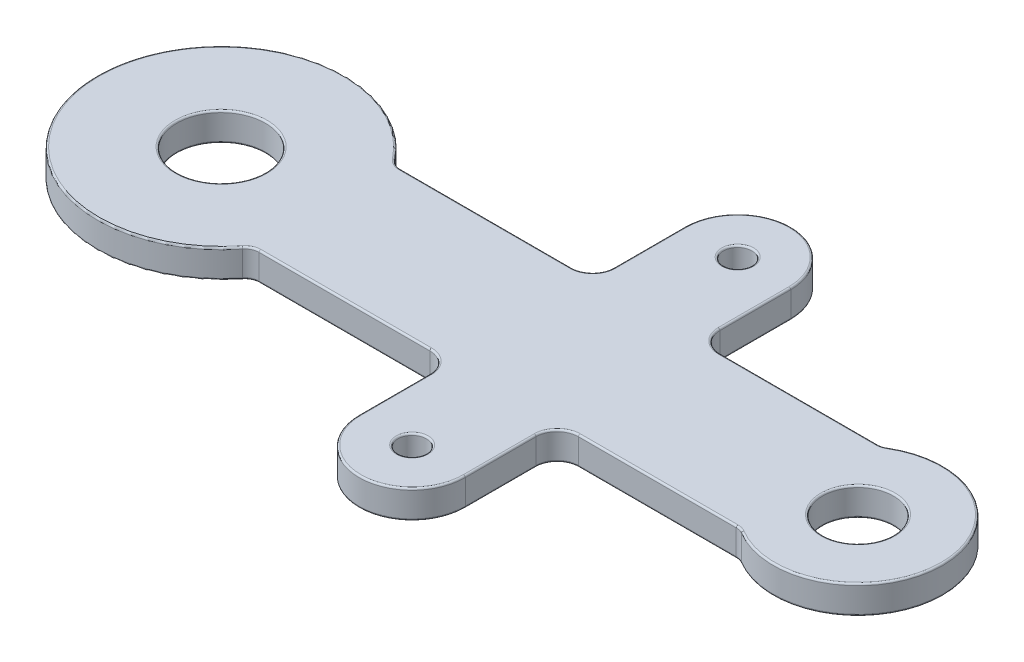
from build123d import *

# Parameters (mm, degrees)
SKETCH_1_R      = 12.5
SKETCH_1_R_2    = 4
SKETCH_1_R_3    = 10
EXTRUDE_1_DEPTH = 8
FILLET_1_R      = 6
FILLET_2_R      = 6
FILLET_3_R      = 6
FILLET_4_R      = 6
FILLET_5_R      = 4
FILLET_6_R      = 4
FILLET_7_R      = 4
FILLET_8_R      = 4
FILLET_9_R      = 0.5


with BuildPart() as part:
    # 草图1 → 凸台-拉伸1 (new body)
    with BuildSketch(Plane(origin=(0, 0, 0), x_dir=(1, 0, 0), z_dir=(0, 1, 0))):
        with BuildLine():
            Line((28.719409623, 20.004887175), (85, 20.004887175))
            Line((85, 20.004887175), (85, 46))
            ThreePointArc((85, 46), (100, 61), (115, 46))
            Line((115, 46), (115, 20.004887175))
            Line((115, 20.004887175), (166.74087148, 20.004887175))
            ThreePointArc((166.74087148, 20.004887175), (204, 0), (166.74087148, -20.004887175))
            Line((166.74087148, -20.004887175), (115, -20.004887175))
            Line((115, -20.004887175), (115, -46))
            ThreePointArc((115, -46), (100, -61), (85, -46))
            Line((85, -46), (85, -20.004887175))
            Line((85, -20.004887175), (28.719409623, -20.004887175))
            ThreePointArc((28.719409623, -20.004887175), (-35, 0), (28.719409623, 20.004887175))
        make_face()
        with Locations(Location((0, 0, 0), (0, 0, 270))):
            Circle(SKETCH_1_R, mode=Mode.SUBTRACT)
        with Locations(Location((100, 46, 0), (0, 0, 270))):
            Circle(SKETCH_1_R_2, mode=Mode.SUBTRACT)
        with Locations(Location((180, 0, 0), (0, 0, 270))):
            Circle(SKETCH_1_R_3, mode=Mode.SUBTRACT)
        with Locations(Location((100, -46, 0), (0, 0, 90))):
            Circle(SKETCH_1_R_2, mode=Mode.SUBTRACT)
    extrude(amount=EXTRUDE_1_DEPTH)

    # 圆角1
    fillet_1_edges = [part.edges().sort_by_distance(p)[0] for p in [
        (85, 4, -20.004887175),
    ]]
    fillet(fillet_1_edges, radius=FILLET_1_R)

    # 圆角2
    fillet_2_edges = [part.edges().sort_by_distance(p)[0] for p in [
        (115, 4, -20.004887175),
    ]]
    fillet(fillet_2_edges, radius=FILLET_2_R)

    # 圆角3
    fillet_3_edges = [part.edges().sort_by_distance(p)[0] for p in [
        (115, 4, 20.004887175),
    ]]
    fillet(fillet_3_edges, radius=FILLET_3_R)

    # 圆角4
    fillet_4_edges = [part.edges().sort_by_distance(p)[0] for p in [
        (85, 4, 20.004887175),
    ]]
    fillet(fillet_4_edges, radius=FILLET_4_R)

    # 圆角5
    fillet_5_edges = [part.edges().sort_by_distance(p)[0] for p in [
        (28.719409623, 4, -20.004887175),
    ]]
    fillet(fillet_5_edges, radius=FILLET_5_R)

    # 圆角6
    fillet_6_edges = [part.edges().sort_by_distance(p)[0] for p in [
        (28.719409623, 4, 20.004887175),
    ]]
    fillet(fillet_6_edges, radius=FILLET_6_R)

    # 圆角7
    fillet_7_edges = [part.edges().sort_by_distance(p)[0] for p in [
        (166.74087148, 4, 20.004887175),
    ]]
    fillet(fillet_7_edges, radius=FILLET_7_R)

    # 圆角8
    fillet_8_edges = [part.edges().sort_by_distance(p)[0] for p in [
        (166.74087148, 4, -20.004887175),
    ]]
    fillet(fillet_8_edges, radius=FILLET_8_R)

    # 圆角9
    fillet_9_edges = [part.edges().sort_by_distance(p)[0] for p in [
        (28.983205897, 8, -20.409879606),
        (54.868518078, 0, 20.004887175),
        (54.868518078, 8, 20.004887175),
        (28.983205897, 8, 20.409879606),
        (28.983205897, 0, 20.409879606),
        (85, 0, -36.002443588),
        (100, 0, -61),
        (204, 0, 0),
        (204, 8, 0),
        (166.654322464, 8, 20.150209602),
        (166.654322464, 0, 20.150209602),
        (143.292965386, 0, -20.004887175),
        (100, 8, 61),
        (143.292965386, 8, -20.004887175),
        (166.654322464, 8, -20.150209602),
        (166.654322464, 0, -20.150209602),
        (115, 0, 36.002443588),
        (100, 0, 61),
        (115, 8, 36.002443588),
        (0, 0, -12.5),
        (0, 8, -12.5),
        (100, 8, -61),
        (100, 0, -50),
        (100, 8, -50),
        (85, 8, -36.002443588),
        (100, 0, 50),
        (100, 8, 50),
        (180, 0, -10),
        (180, 8, -10),
        (54.868518078, 0, -20.004887175),
        (54.868518078, 8, -20.004887175),
        (83.242640687, 0, -21.762246488),
        (83.242640687, 8, -21.762246488),
        (115, 0, -36.002443588),
        (115, 8, -36.002443588),
        (116.757359313, 8, -21.762246488),
        (116.757359313, 0, -21.762246488),
        (143.292965386, 0, 20.004887175),
        (143.292965386, 8, 20.004887175),
        (116.757359313, 8, 21.762246488),
        (116.757359313, 0, 21.762246488),
        (85, 0, 36.002443588),
        (85, 8, 36.002443588),
        (83.242640687, 8, 21.762246488),
        (83.242640687, 0, 21.762246488),
        (-35, 0, 0),
        (-35, 8, 0),
        (28.983205897, 0, -20.409879606),
    ]]
    fillet(fillet_9_edges, radius=FILLET_9_R)


solid = part.part
